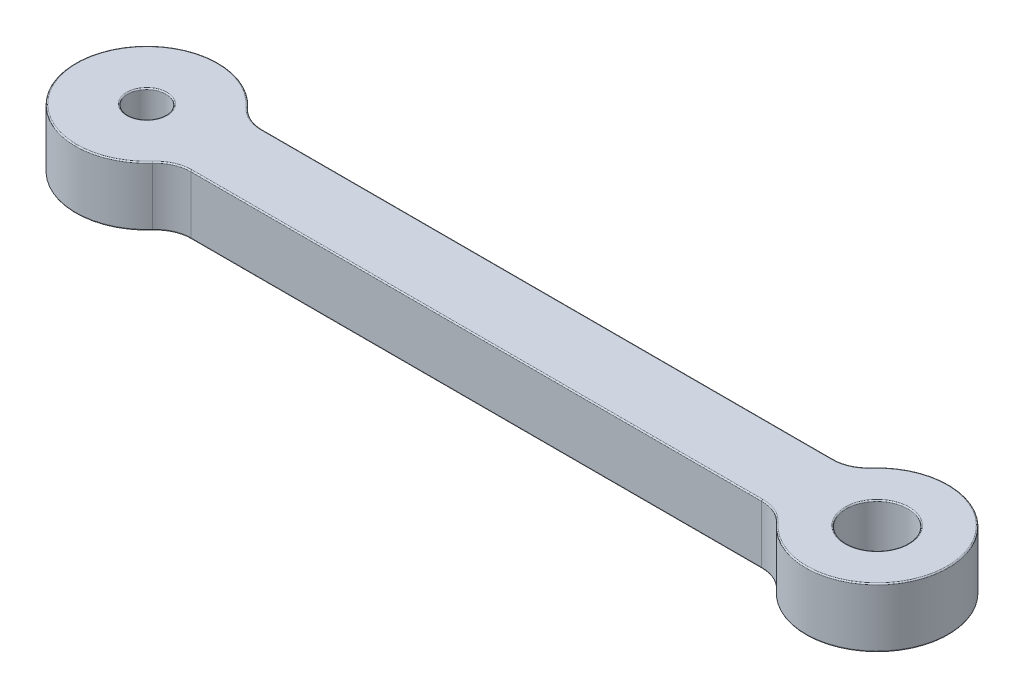
from build123d import *

# Parameters (mm, degrees)
SKETCH1_R           = 1.6
SKETCH1_R_2         = 2.6
BOSS_EXTRUDE1_DEPTH = 5
FILLET1_R           = 0.1


with BuildPart() as part:
    # Sketch1 → Boss-Extrude1 (new body)
    with BuildSketch(Plane(origin=(0, 0, 0), x_dir=(1, 0, 0), z_dir=(0, 1, 0))):
        with BuildLine():
            Line((6.708203932, 3), (54.708203932, 3))
            ThreePointArc((54.708203932, 3), (55.932948804, 3.261387212), (56.94427191, 4))
            ThreePointArc((56.94427191, 4), (67.416407865, 0), (56.94427191, -4))
            ThreePointArc((56.94427191, -4), (55.932948804, -3.261387212), (54.708203932, -3))
            Line((54.708203932, -3), (6.708203932, -3))
            ThreePointArc((6.708203932, -3), (5.483459061, -3.261387212), (4.472135955, -4))
            ThreePointArc((4.472135955, -4), (-6, 0), (4.472135955, 4))
            ThreePointArc((4.472135955, 4), (5.483459061, 3.261387212), (6.708203932, 3))
        make_face()
        with Locations(Location((0, 0, 0), (0, 0, 270))):
            Circle(SKETCH1_R, mode=Mode.SUBTRACT)
        with Locations(Location((61.416407865, 0, 0), (0, 0, 270))):
            Circle(SKETCH1_R_2, mode=Mode.SUBTRACT)
    extrude(amount=BOSS_EXTRUDE1_DEPTH)

    # Fillet1
    fillet1_edges = [part.edges().sort_by_distance(p)[0] for p in [
        (55.932948804, 0, -3.261387212),
        (67.416407865, 0, 0),
        (61.416407865, 5, -2.6),
        (55.932948804, 0, 3.261387212),
        (30.708203932, 0, 3),
        (5.483459061, 0, 3.261387212),
        (-6, 0, 0),
        (5.483459061, 0, -3.261387212),
        (30.708203932, 0, -3),
        (61.416407865, 0, -2.6),
        (0, 0, -1.6),
        (30.708203932, 5, -3),
        (5.483459061, 5, -3.261387212),
        (-6, 5, 0),
        (5.483459061, 5, 3.261387212),
        (30.708203932, 5, 3),
        (55.932948804, 5, 3.261387212),
        (67.416407865, 5, 0),
        (55.932948804, 5, -3.261387212),
        (0, 5, -1.6),
    ]]
    fillet(fillet1_edges, radius=FILLET1_R)


solid = part.part
